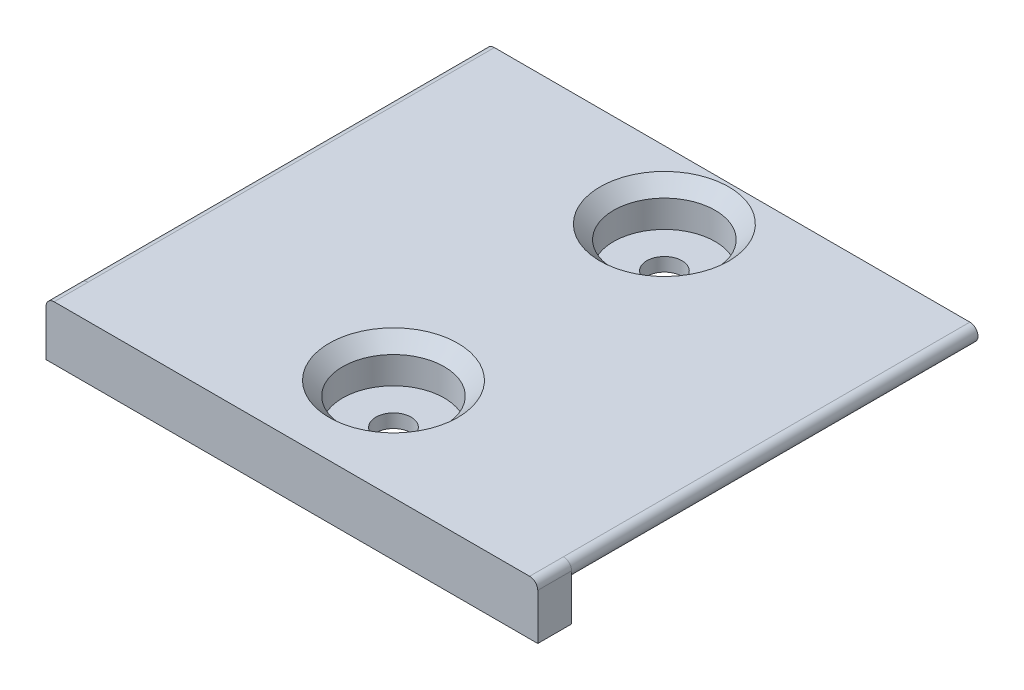
from build123d import *

# Parameters (mm, degrees)
EXTRUDE_1_DEPTH     = 60
SKETCH_2_R          = 2.6
CUT_EXTRUDE_1_DEPTH = 8
SKETCH_3_R          = 7.5
CUT_EXTRUDE_2_DEPTH = 6
FILLET_2_R          = 1.2
SKETCH_4_W          = 72.60588745
SKETCH_4_H          = 8
EXTRUDE_2_DEPTH     = 5
FILLET_3_R          = 1.2
CHAMFER_3_SIZE      = 2


with BuildPart() as part:
    # Эскиз1 → Бобышка-Вытянуть1 (new body)
    with BuildSketch(Plane.XY):
        Polygon((-30, 0), (30, 0), (38, 8), (-38, 8), align=None)
    extrude(amount=EXTRUDE_1_DEPTH)

    # Эскиз2 → Вырез-Вытянуть1 (cut)
    with BuildSketch(Plane(origin=(0, 8, 0), x_dir=(1, 0, 0), z_dir=(0, 1, 0))):
        with Locations(Location((0, -10, 0), (0, 0, 180))):
            Circle(SKETCH_2_R)
        with Locations(Location((0, -50, 0), (0, 0, 180))):
            Circle(SKETCH_2_R)
    extrude(amount=-CUT_EXTRUDE_1_DEPTH, mode=Mode.SUBTRACT)

    # Эскиз3 → Вырез-Вытянуть2 (cut)
    with BuildSketch(Plane(origin=(0, 8, 0), x_dir=(1, 0, 0), z_dir=(0, 1, 0))):
        with Locations(Location((0, -10, 0), (0, 0, 180))):
            Circle(SKETCH_3_R)
        with Locations(Location((0, -50, 0), (0, 0, 180))):
            Circle(SKETCH_3_R)
    extrude(amount=-CUT_EXTRUDE_2_DEPTH, mode=Mode.SUBTRACT)

    # Скругление2
    fillet_2_edges = [part.edges().sort_by_distance(p)[0] for p in [
        (-38, 8, 30),
        (38, 8, 30),
    ]]
    fillet(fillet_2_edges, radius=FILLET_2_R)

    # Эскиз4 → Бобышка-Вытянуть2 (add)
    with BuildSketch(Plane.XY.offset(60)):
        with Locations((0, 4)):
            Rectangle(SKETCH_4_W, SKETCH_4_H)
    extrude(amount=EXTRUDE_2_DEPTH)

    # Скругление3
    fillet_3_edges = [part.edges().sort_by_distance(p)[0] for p in [
        (36.302943725, 8, 62.5),
        (-36.302943725, 8, 62.5),
    ]]
    fillet(fillet_3_edges, radius=FILLET_3_R)

    # Фаска3
    chamfer_3_edges = [part.edges().sort_by_distance(p)[0] for p in [
        (7.5, 8, 10),
        (7.5, 8, 50),
    ]]
    chamfer(chamfer_3_edges, length=CHAMFER_3_SIZE)


solid = part.part
